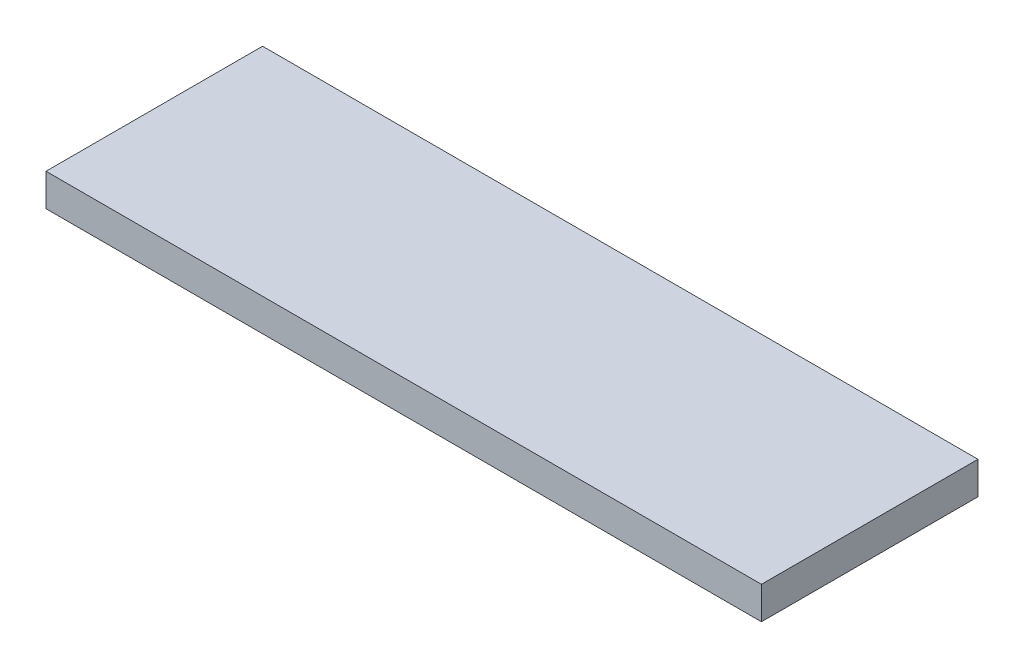
from build123d import *

# Parameters (mm, degrees)
SKETCH1_W           = 66.04
SKETCH1_H           = 19.9898
BOSS_EXTRUDE1_DEPTH = 2.9972


with BuildPart() as part:
    # Sketch1 → Boss-Extrude1 (new body)
    with BuildSketch(Plane(origin=(0, 0, 0), x_dir=(1, 0, 0), z_dir=(0, 1, 0))):
        Rectangle(SKETCH1_W, SKETCH1_H)
    extrude(amount=BOSS_EXTRUDE1_DEPTH)


solid = part.part
